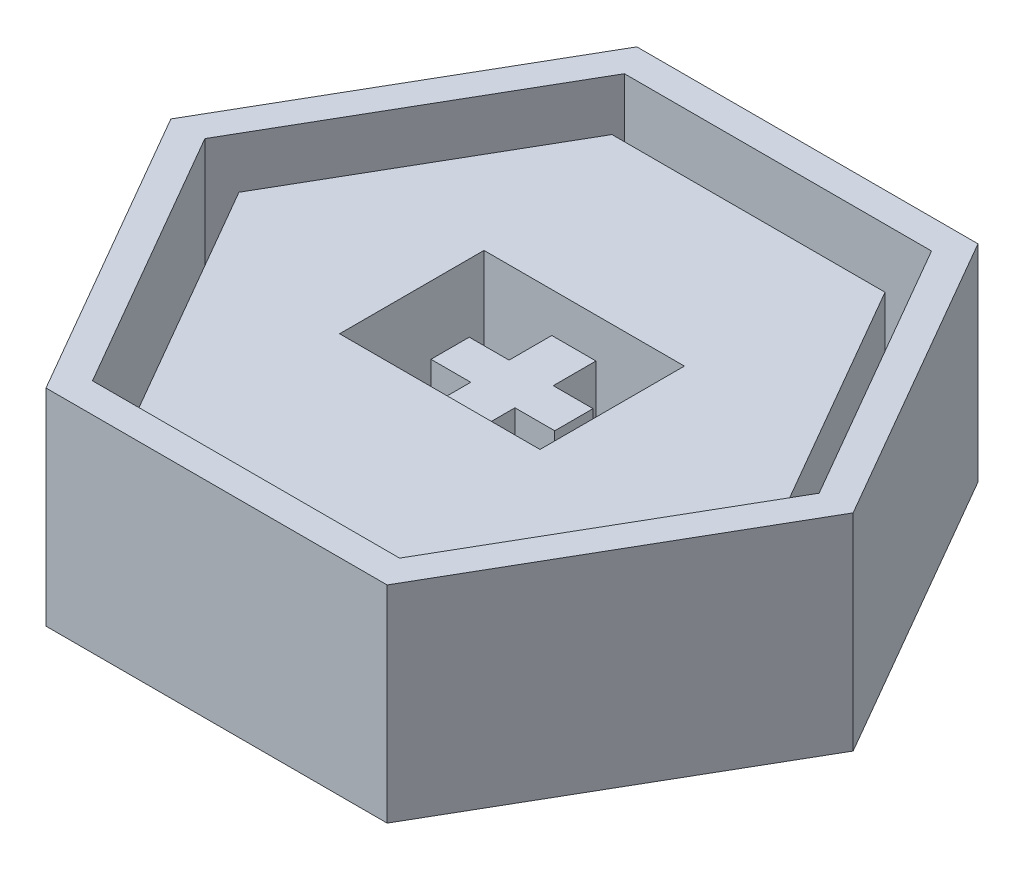
from build123d import *

# Parameters (mm, degrees)
BOSS_EXTRUDE1_DEPTH = 1
BOSS_EXTRUDE2_DEPTH = 7
SKETCH3_W           = 6.8
SKETCH3_H           = 4.9
BOSS_EXTRUDE3_DEPTH = 5
BOSS_EXTRUDE4_DEPTH = 4


with BuildPart() as part:
    # Sketch1 → Boss-Extrude1 (new body)
    with BuildSketch(Plane(origin=(0, 0, 0), x_dir=(1, 0, 0), z_dir=(0, 1, 0))):
        Polygon((10.421172359, 0), (5.210586179, 9.025), (-5.210586179, 9.025), (-10.421172359, 0), (-5.210586179, -9.025), (5.210586179, -9.025), align=None)
    extrude(amount=BOSS_EXTRUDE1_DEPTH)



with BuildPart() as body_2:
    # Sketch2 → Boss-Extrude2 (new body)
    with BuildSketch(Plane.XZ):
        Polygon((11.575872897, 0), (5.787936449, 10.025), (-5.787936449, 10.025), (-11.575872897, 0), (-5.787936449, -10.025), (5.787936449, -10.025), align=None)
        Polygon((10.421172359, 0), (5.210586179, 9.025), (-5.210586179, 9.025), (-10.421172359, 0), (-5.210586179, -9.025), (5.210586179, -9.025), align=None, mode=Mode.SUBTRACT)
    extrude(amount=-BOSS_EXTRUDE2_DEPTH)


with BuildPart() as part_1:
    add(part.part)

    add(body_2.part)  # Boss-Extrude3 merges body 2
    # Sketch3 → Boss-Extrude3 (add)
    with BuildSketch(Plane(origin=(0, 1, 0), x_dir=(1, 0, 0), z_dir=(0, 1, 0))):
        Polygon((4.63323591, -8.025), (9.26647182, 0), (4.63323591, 8.025), (-4.63323591, 8.025), (-9.26647182, 0), (-4.63323591, -8.025), align=None)
        Rectangle(SKETCH3_W, SKETCH3_H, mode=Mode.SUBTRACT)
    extrude(amount=BOSS_EXTRUDE3_DEPTH)

    # Sketch4 → Boss-Extrude4 (add)
    with BuildSketch(Plane(origin=(0, 1, 0), x_dir=(1, 0, 0), z_dir=(0, 1, 0))):
        Polygon((-0.75, 2.1), (0.75, 2.1), (0.75, 0.65), (2.1, 0.65), (2.1, -0.65), (0.75, -0.65), (0.75, -2.1), (-0.75, -2.1), (-0.75, -0.65), (-2.1, -0.65), (-2.1, 0.65), (-0.75, 0.65), align=None)
    extrude(amount=BOSS_EXTRUDE4_DEPTH)


solid = part_1.part
